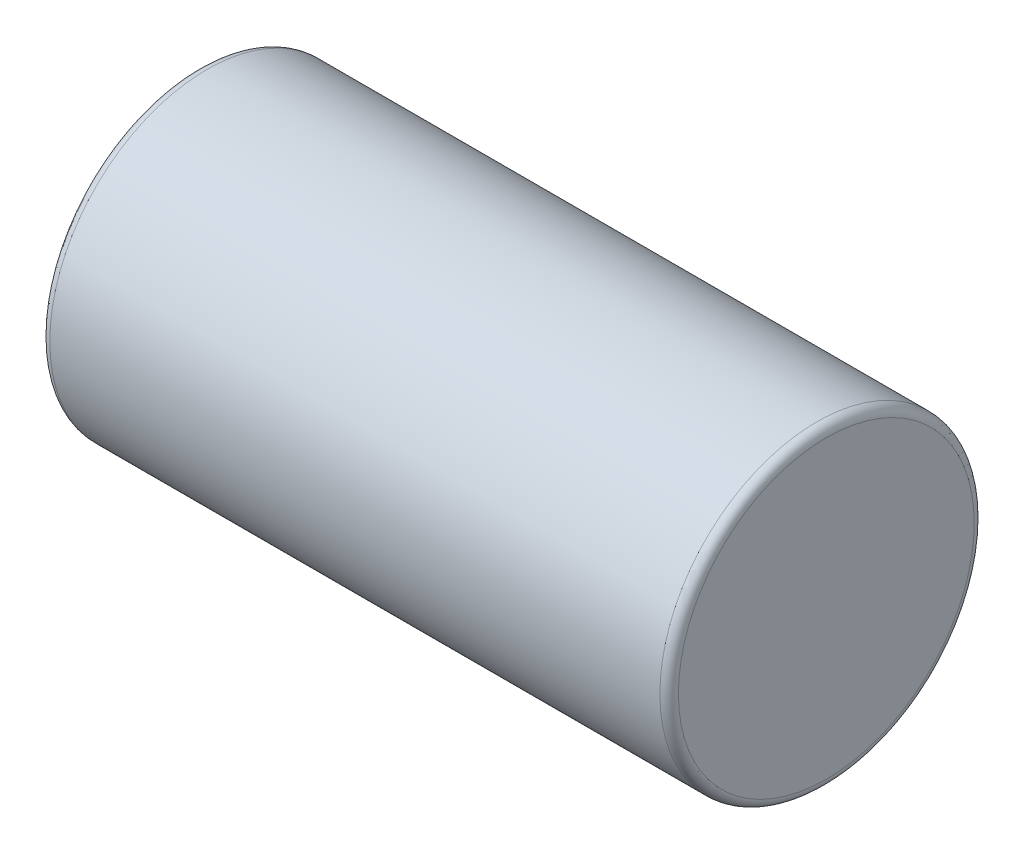
from build123d import *

# Parameters (mm, degrees)
SKETCH_2_R      = 8.5
EXTRUDE_1_DEPTH = 34
FILLET_1_R      = 0.5


with BuildPart() as part:
    # Эскиз2 → Бобышка-Вытянуть1 (new body)
    with BuildSketch(Plane(origin=(0, 0, 0), x_dir=(0, 0, -1), z_dir=(1, 0, 0))):
        Circle(SKETCH_2_R)
    extrude(amount=-EXTRUDE_1_DEPTH)

    # Скругление1
    fillet_1_edges = [part.edges().sort_by_distance(p)[0] for p in [
        (0, 0, 8.5),
        (-34, 0, 8.5),
    ]]
    fillet(fillet_1_edges, radius=FILLET_1_R)


solid = part.part
